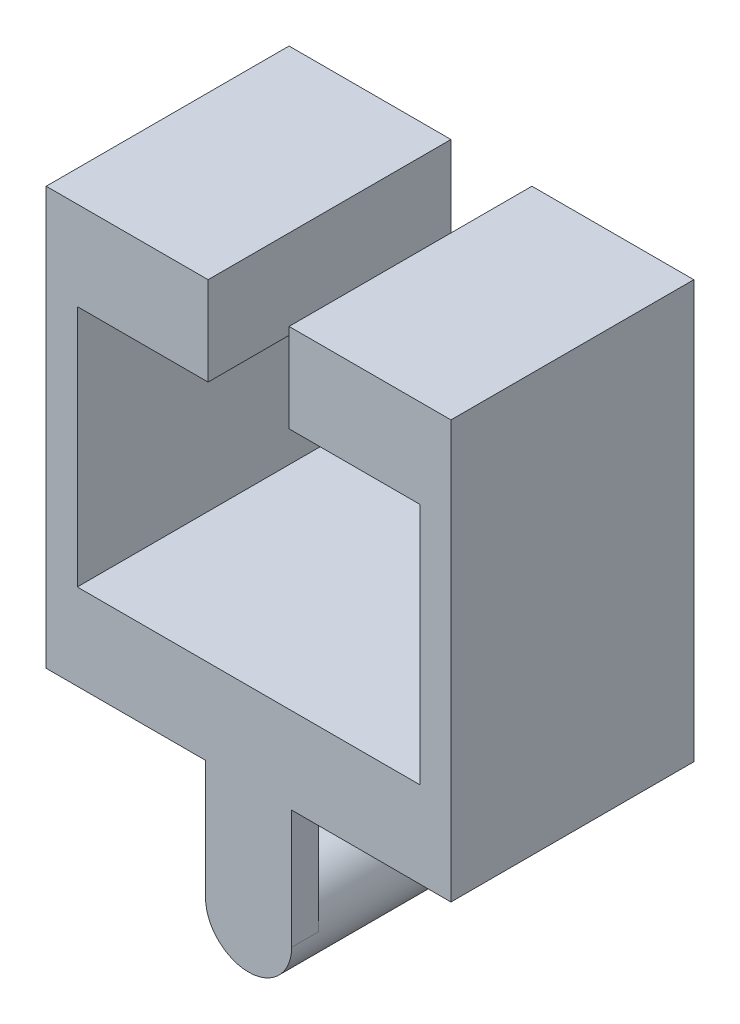
from build123d import *

# Parameters (mm, degrees)
SKETCH1_R            = 6.7564
BOSS_EXTRUDE2_DEPTH  = 38.1
SKETCH2_W            = 13.5128
SKETCH2_H            = 18.6436
BOSS_EXTRUDE3_DEPTH  = 4.23926
BOSS_EXTRUDE6_DEPTH  = 13.49502
SKETCH7_W            = 4.8768
SKETCH7_H            = 38.1
BOSS_EXTRUDE10_DEPTH = 38.1
SKETCH8_W            = 25.4
SKETCH8_H            = 38.1
BOSS_EXTRUDE11_DEPTH = 13.91158


with BuildPart() as part:
    # Sketch1 → Boss-Extrude2 (new body)
    with BuildSketch(Plane.XY):
        with Locations(Location((0, 0, 0), (0, 0, 180))):
            Circle(SKETCH1_R)
    extrude(amount=BOSS_EXTRUDE2_DEPTH)

    # Sketch2 → Boss-Extrude3 (add)
    with BuildSketch(Plane.XY.offset(38.1)):
        with Locations((0, 9.3218)):
            Rectangle(SKETCH2_W, SKETCH2_H)
    extrude(amount=-BOSS_EXTRUDE3_DEPTH)

    # Sketch4 → Boss-Extrude6 (add)
    with BuildSketch(Plane(origin=(0, 18.6436, 0), x_dir=(1, 0, 0), z_dir=(0, 1, 0))):
        Polygon((0, -38.1), (-31.75, -38.1), (-31.75, 0), (31.75, 0), (31.75, -38.1), align=None)
    extrude(amount=BOSS_EXTRUDE6_DEPTH)

    # Sketch7 → Boss-Extrude10 (add)
    with BuildSketch(Plane(origin=(0, 32.13862, 0), x_dir=(1, 0, 0), z_dir=(0, 1, 0))):
        with Locations((-29.3116, -19.05)):
            Rectangle(SKETCH7_W, SKETCH7_H)
        with Locations((29.3116, -19.05)):
            Rectangle(SKETCH7_W, SKETCH7_H)
    extrude(amount=BOSS_EXTRUDE10_DEPTH)

    # Sketch8 → Boss-Extrude11 (add)
    with BuildSketch(Plane(origin=(0, 70.23862, 0), x_dir=(1, 0, 0), z_dir=(0, 1, 0))):
        with Locations((-19.05, -19.05)):
            Rectangle(SKETCH8_W, SKETCH8_H)
        with Locations((19.05, -19.05)):
            Rectangle(SKETCH8_W, SKETCH8_H)
    extrude(amount=BOSS_EXTRUDE11_DEPTH)


solid = part.part
